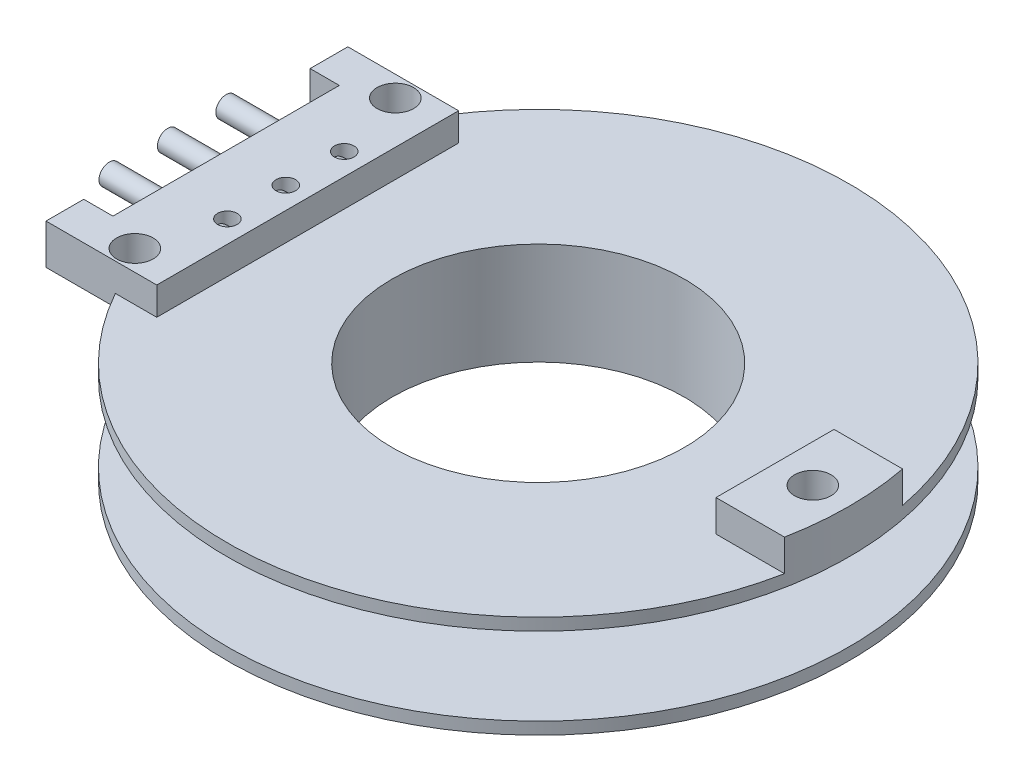
from build123d import *

# Parameters (mm, degrees)
EXTRUDE_1_DEPTH        = 1.3
EXTRUDE_2_DEPTH        = 1.15
EXTRUDE_2_DEPTH_BACK   = 0.5
SKETCH_4_R             = 0.75
CUT_EXTRUDE_1_DEPTH    = 1.65
SKETCH_5_R             = 0.4
CUT_EXTRUDE_2_DEPTH    = 1.55
EXTRUDE_3_DEPTH        = 2.4
EXTRUDE_3_DEPTH_BACK   = 3
SKETCH_6_R             = 0.425
EXTRUDE_3_2_DEPTH      = 2.4
EXTRUDE_3_2_DEPTH_BACK = 3
EXTRUDE_3_3_DEPTH      = 2.4
EXTRUDE_3_3_DEPTH_BACK = 3
SKETCH_7_R             = 0.75
CUT_EXTRUDE_3_DEPTH    = 1.8


with BuildPart() as part:
    # Эскиз1 → Повернуть1 (revolve)
    with BuildSketch(Plane.XY, mode=Mode.PRIVATE) as revolve_1_sk:
        Polygon((7, 1.6), (7, -1.6), (12.775, -1.6), (12.775, -2.1), (6, -2.1), (6, 2.1), (12.775, 2.1), (12.775, 1.6), align=None)
    revolve(revolve_1_sk.sketch.rotate(Axis((0, 2.1, 0), (0, -1, 0)), 180), axis=Axis((0, 2.1, 0), (0, -1, 0)))

    # Эскиз2 → Бобышка-Вытянуть1 (add)
    with BuildSketch(Plane(origin=(0, 2.1, 0), x_dir=(1, 0, 0), z_dir=(0, 1, 0))):
        with BuildLine():
            Line((9.727281223, 2.425), (12.542726976, 2.425))
            ThreePointArc((12.542726976, 2.425), (12.775, 0), (12.542726976, -2.425))
            Line((12.542726976, -2.425), (9.727281223, -2.425))
            Line((9.727281223, -2.425), (9.727281223, 2.425))
        make_face()
    extrude(amount=EXTRUDE_1_DEPTH)

    # Эскиз3 → Бобышка-Вытянуть2 (add, two sides: drawn at the far end of the back side and taken through both)
    with BuildSketch(Plane(origin=(0, 2.1, 0), x_dir=(1, 0, 0), z_dir=(0, 1, 0)).offset(-EXTRUDE_2_DEPTH_BACK)):
        Polygon((-14.02, 6.2), (-9.47, 6.2), (-9.47, -6.2), (-14.02, -6.2), (-14.02, -4.65), (-12.82, -4.65), (-12.82, 4.65), (-14.02, 4.65), align=None)
    extrude(amount=EXTRUDE_2_DEPTH + EXTRUDE_2_DEPTH_BACK)

    # Эскиз4 → Вырез-Вытянуть1 (cut)
    with BuildSketch(Plane(origin=(0, 3.25, 0), x_dir=(1, 0, 0), z_dir=(0, 1, 0))):
        with Locations(Location((-11.22, 5.35, 0), (0, 0, 180))):
            Circle(SKETCH_4_R)
        with Locations(Location((-11.22, -5.35, 0), (0, 0, 180))):
            Circle(SKETCH_4_R)
    extrude(amount=-CUT_EXTRUDE_1_DEPTH, mode=Mode.SUBTRACT)

    # Эскиз5 → Вырез-Вытянуть2 (cut)
    with BuildSketch(Plane(origin=(0, 3.25, 0), x_dir=(1, 0, 0), z_dir=(0, 1, 0))):
        with Locations(Location((-10.37, 2.4, 0), (0, 0, 180))):
            Circle(SKETCH_5_R)
        with Locations(Location((-10.37, 0, 0), (0, 0, 180))):
            Circle(SKETCH_5_R)
        with Locations(Location((-10.37, -2.4, 0), (0, 0, 180))):
            Circle(SKETCH_5_R)
    extrude(amount=-CUT_EXTRUDE_2_DEPTH, mode=Mode.SUBTRACT)

    # Эскиз7 → Вырез-Вытянуть3 (cut)
    with BuildSketch(Plane(origin=(0, 3.4, 0), x_dir=(1, 0, 0), z_dir=(0, 1, 0))):
        with Locations(Location((11.28, 0, 0), (0, 0, 180))):
            Circle(SKETCH_7_R)
    extrude(amount=-CUT_EXTRUDE_3_DEPTH, mode=Mode.SUBTRACT)


with BuildPart() as body_2:
    # Эскиз6 → Бобышка-Вытянуть3 (new, two sides: drawn at the far end of the back side and taken through both)
    with BuildSketch(Plane.ZY.offset(12.82).offset(-EXTRUDE_3_DEPTH_BACK)):
        with Locations(Location((0, 2.425, 0), (0, 0, 270))):
            Circle(SKETCH_6_R)
    extrude(amount=EXTRUDE_3_DEPTH + EXTRUDE_3_DEPTH_BACK)


with BuildPart() as body_3:
    # Эскиз6 → Extrude 3 2 (new, two sides: drawn at the far end of the back side and taken through both)
    with BuildSketch(Plane.ZY.offset(12.82).offset(-EXTRUDE_3_2_DEPTH_BACK)):
        with Locations(Location((2.4, 2.425, 0), (0, 0, 270))):
            Circle(SKETCH_6_R)
    extrude(amount=EXTRUDE_3_2_DEPTH + EXTRUDE_3_2_DEPTH_BACK)


with BuildPart() as body_4:
    # Эскиз6 → Extrude 3 3 (new, two sides: drawn at the far end of the back side and taken through both)
    with BuildSketch(Plane.ZY.offset(12.82).offset(-EXTRUDE_3_3_DEPTH_BACK)):
        with Locations(Location((-2.4, 2.425, 0), (0, 0, 270))):
            Circle(SKETCH_6_R)
    extrude(amount=EXTRUDE_3_3_DEPTH + EXTRUDE_3_3_DEPTH_BACK)


solid = Compound([part.part, body_2.part, body_3.part, body_4.part])
